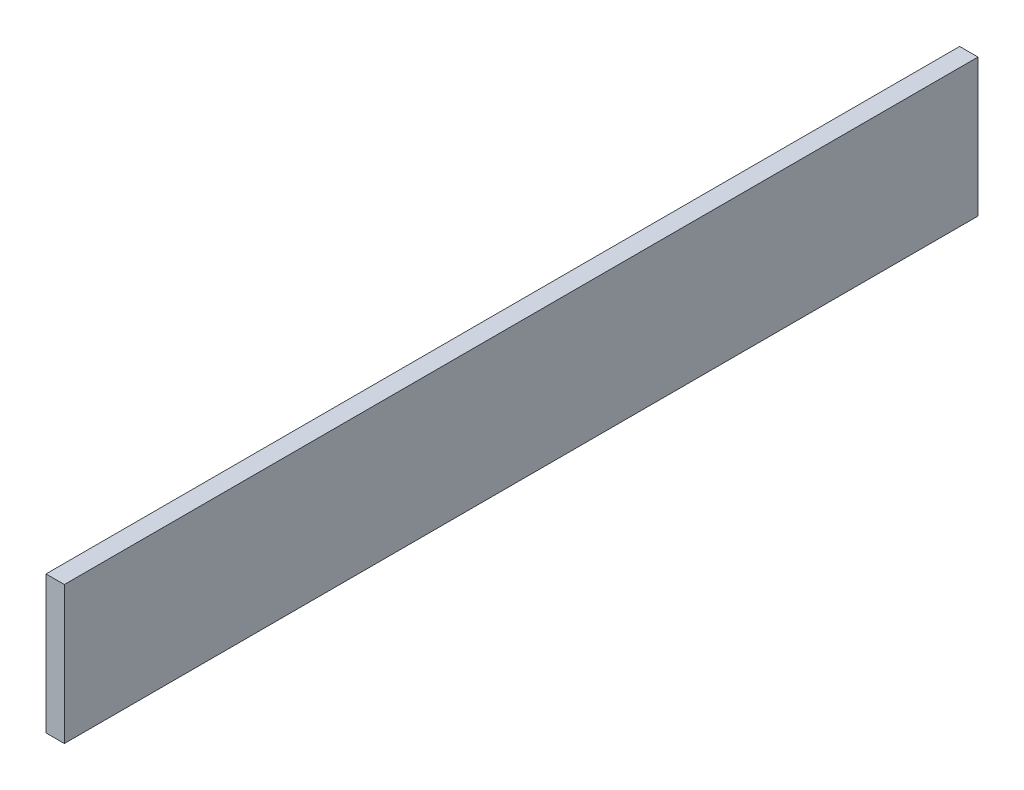
from build123d import *

# Parameters (mm, degrees)
SKETCH1_W           = 8
SKETCH1_H           = 60
BOSS_EXTRUDE1_DEPTH = 199


with BuildPart() as part:
    # Sketch1 → Boss-Extrude1 (new, symmetric)
    with BuildSketch(Plane.XY):
        Rectangle(SKETCH1_W, SKETCH1_H)
    extrude(amount=BOSS_EXTRUDE1_DEPTH, both=True)


solid = part.part
